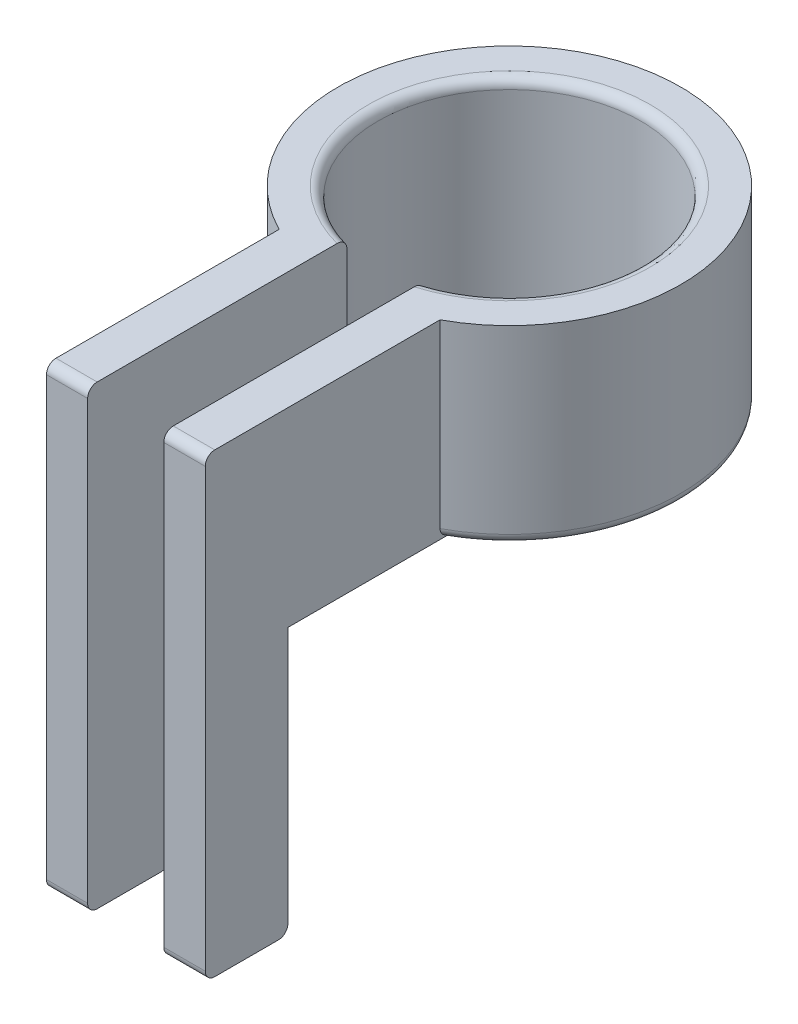
from build123d import *

# Parameters (mm, degrees)
SKETCH1_R           = 9
SKETCH1_R_2         = 6.9
BOSS_EXTRUDE1_DEPTH = 10
SKETCH2_W           = 4
SKETCH2_H           = 7.765292285
CUT_EXTRUDE1_DEPTH  = 14
SKETCH3_W           = 2.178666284
SKETCH3_H           = 14.18086127
SKETCH3_W_2         = 2.164116959
SKETCH3_H_2         = 14.122068743
BOSS_EXTRUDE2_DEPTH = 10
SKETCH4_W           = 2.178666284
SKETCH4_H           = 7.791069301
SKETCH4_W_2         = 2.164116959
BOSS_EXTRUDE3_DEPTH = 18
SKETCH5_W           = 23.023428876
SKETCH5_H           = 2.946570651
CUT_EXTRUDE2_DEPTH  = 18
SKETCH6_R           = 37.134957589
CUT_EXTRUDE3_DEPTH  = 0.5
FILLET1_R           = 0.5
FILLET2_R           = 0.5
FILLET3_R           = 0.5


with BuildPart() as part:
    # Sketch1 → Boss-Extrude1 (new body)
    with BuildSketch(Plane(origin=(0, 0, 0), x_dir=(1, 0, 0), z_dir=(0, 1, 0))):
        with Locations(Location((0, 0, 0), (0, 0, 270))):
            Circle(SKETCH1_R)
        with Locations(Location((0, 0, 0), (0, 0, 270))):
            Circle(SKETCH1_R_2, mode=Mode.SUBTRACT)
    extrude(amount=BOSS_EXTRUDE1_DEPTH)

    # Sketch2 → Cut-Extrude1 (cut)
    with BuildSketch(Plane(origin=(0, 10, 0), x_dir=(1, 0, 0), z_dir=(0, 1, 0))):
        with Locations((0.097051884, -9.080757725)):
            Rectangle(SKETCH2_W, SKETCH2_H)
    extrude(amount=-CUT_EXTRUDE1_DEPTH, mode=Mode.SUBTRACT)

    # Sketch3 → Boss-Extrude2 (add)
    with BuildSketch(Plane(origin=(0, 10, 0), x_dir=(1, 0, 0), z_dir=(0, 1, 0))):
        with Locations((3.186385026, -13.664042534)):
            Rectangle(SKETCH3_W, SKETCH3_H)
        with Locations((-2.985006596, -13.693438798)):
            Rectangle(SKETCH3_W_2, SKETCH3_H_2)
    extrude(amount=-BOSS_EXTRUDE2_DEPTH)

    # Sketch4 → Boss-Extrude3 (add)
    with BuildSketch(Plane(origin=(0, -13.970289025, 0), x_dir=(1, 0, 0), z_dir=(0, 1, 0))):
        with Locations((3.186385026, -16.858938519)):
            Rectangle(SKETCH4_W, SKETCH4_H)
        with Locations((-2.985006596, -16.858938519)):
            Rectangle(SKETCH4_W_2, SKETCH4_H)
    extrude(amount=BOSS_EXTRUDE3_DEPTH)

    # Sketch5 → Cut-Extrude2 (cut)
    with BuildSketch(Plane(origin=(0, 0, 0), x_dir=(-1, 0, 0), z_dir=(0, -1, 0))):
        with Locations((7.23599627, -14.436689194)):
            Rectangle(SKETCH5_W, SKETCH5_H)
    extrude(amount=CUT_EXTRUDE2_DEPTH, mode=Mode.SUBTRACT)

    # Sketch6 → Cut-Extrude3 (cut)
    with BuildSketch(Plane.XY.offset(20.754473169)):
        with Locations((-4.067065075, 10)):
            Circle(SKETCH6_R)
    extrude(amount=-CUT_EXTRUDE3_DEPTH, mode=Mode.SUBTRACT)

    # Fillet1
    fillet1_edges = [part.edges().sort_by_distance(p)[0] for p in [
        (-2.985006595, -13.970289025, 15.909974519),
        (3.186385026, -13.970289025, 15.909974519),
        (3.186385026, 10, 20.254473169),
        (-2.985006595, 10, 20.254473169),
        (3.186385026, -13.970289025, 20.254473169),
        (-2.985006595, -13.970289025, 20.254473169),
    ]]
    fillet(fillet1_edges, radius=FILLET1_R)

    # Fillet2
    fillet2_edges = [part.edges().sort_by_distance(p)[0] for p in [
        (-0.117739094, 0, -8.999229828),
    ]]
    fillet(fillet2_edges, radius=FILLET2_R)

    # Fillet3
    fillet3_edges = [part.edges().sort_by_distance(p)[0] for p in [
        (-0.101406156, 10, -6.8992548),
    ]]
    fillet(fillet3_edges, radius=FILLET3_R)


solid = part.part
